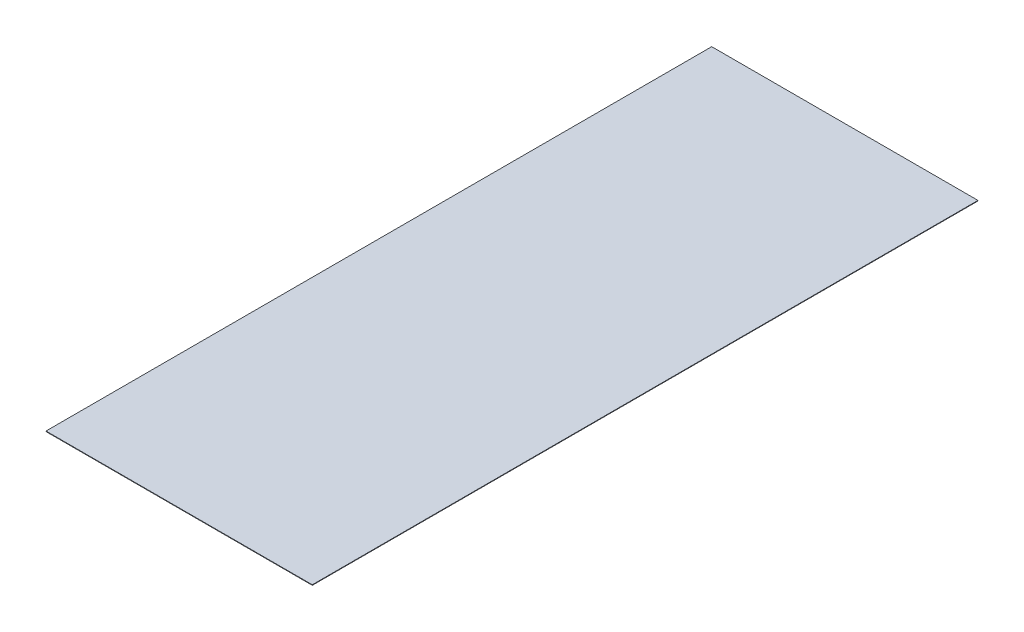
from build123d import *

# Parameters (mm, degrees)
CROQUIS1_W              = 1219.2
CROQUIS1_H              = 3048
SALIENTE_EXTRUIR1_DEPTH = 2.3


with BuildPart() as part:
    # Croquis1 → Saliente-Extruir1 (new body)
    with BuildSketch(Plane(origin=(0, 0, 0), x_dir=(1, 0, 0), z_dir=(0, 1, 0))):
        Rectangle(CROQUIS1_W, CROQUIS1_H)
    extrude(amount=SALIENTE_EXTRUIR1_DEPTH)


solid = part.part
